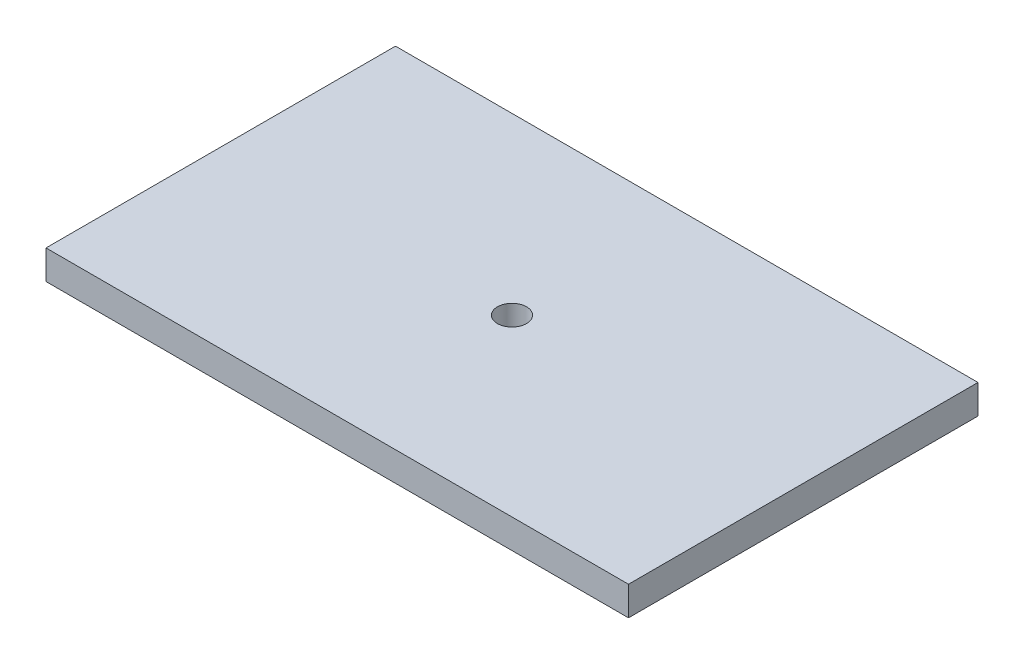
from build123d import *

# Parameters (mm, degrees)
SKETCH1_W           = 200
SKETCH1_H           = 120
SKETCH1_R           = 5
BOSS_EXTRUDE1_DEPTH = 10


with BuildPart() as part:
    # Sketch1 → Boss-Extrude1 (new body)
    with BuildSketch(Plane(origin=(0, 0, 0), x_dir=(1, 0, 0), z_dir=(0, 1, 0))):
        Rectangle(SKETCH1_W, SKETCH1_H)
        with Locations(Location((0, 0, 0), (0, 0, 270))):
            Circle(SKETCH1_R, mode=Mode.SUBTRACT)
    extrude(amount=BOSS_EXTRUDE1_DEPTH)


solid = part.part
